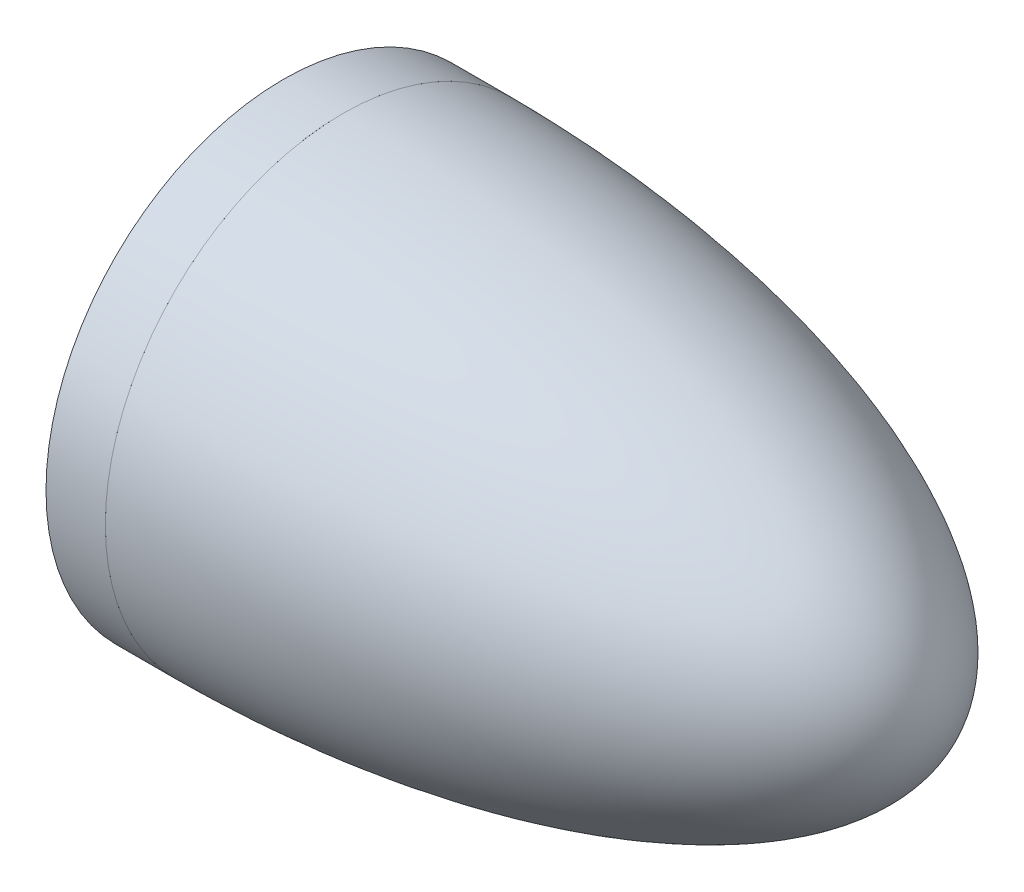
from build123d import *

# Parameters (mm, degrees)
SKETCH6_R           = 20
BOSS_EXTRUDE6_DEPTH = 5
SKETCH7_W           = 2.51
SKETCH7_H           = 2.51
CUT_EXTRUDE2_DEPTH  = 4


with BuildPart() as part:
    # Sketch5 → Revolve1 (revolve)
    with BuildSketch(Plane.XY, mode=Mode.PRIVATE) as revolve1_sk:
        with BuildLine():
            Line((-0.328961319, 20), (0, 0))
            Line((0, 0), (49.671038681, 0))
            add(Edge.make_bspline(
                [(-0.328961319, 20), (-0.105238787, 20), (0.346683768, 19.998738518), (1.17344146, 19.993061836), (2.07946465, 19.97791728), (3.088023411, 19.955183498), (4.039946825, 19.924840097), (5.023208706, 19.886859758), (5.988955504, 19.841208052), (7.206007116, 19.774502332), (8.660085037, 19.678931594), (10.358210996, 19.544546485), (12.294101895, 19.358997269), (14.227685252, 19.140764557), (16.156551584, 18.888978238), (18.080976902, 18.602600939), (19.999508375, 18.280402065), (21.911557404, 17.920937974), (23.815801584, 17.522506625), (26.184896379, 16.973278777), (28.536388947, 16.351883769), (30.865797773, 15.651486078), (33.626471787, 14.704732977), (36.158486008, 13.715434332), (38.632307398, 12.58508043), (41.01950592, 11.282461155), (42.901793813, 10.082177334), (44.375669895, 8.994767711), (45.639838989, 7.904036264), (46.6882672, 6.838589372), (47.489746286, 5.877342008), (48.134030074, 4.956724542), (48.638593095, 4.08034154), (49.033772714, 3.23104563), (49.343490389, 2.35581971), (49.563253783, 1.448045849), (49.651047512, 0.731297667), (49.67103155, 0.248502323), (49.671038681, 0)],
                knots=[0.079977795, 0.079977795, 0.079977795, 0.079977795, 0.079977795, 0.095532234, 0.111086674, 0.126641113, 0.142195553, 0.157749993, 0.173304433, 0.188858873, 0.204413313, 0.235522191, 0.266631069, 0.297739947, 0.328848826, 0.359957705, 0.391066585, 0.422175461, 0.453284338, 0.484393222, 0.515502106, 0.577719847, 0.608828732, 0.639937617, 0.702155324, 0.751534088, 0.78264288, 0.813751735, 0.844860411, 0.868585912, 0.889324944, 0.909266927, 0.924820517, 0.940371705, 0.953929868, 0.969106253, 0.984110411, 1, 1, 1, 1, 1], degree=4))
        make_face()
    revolve(revolve1_sk.sketch.rotate(Axis((0, 0, 0), (1, 0, 0)), 180), axis=Axis((0, 0, 0), (1, 0, 0)))

    # Sketch6 → Boss-Extrude6 (add)
    with BuildSketch(Plane(origin=(0, 0, 0), x_dir=(0, 0, -1), z_dir=(1, 0, 0))):
        Circle(SKETCH6_R)
    extrude(amount=-BOSS_EXTRUDE6_DEPTH)

    # Sketch7 → Cut-Extrude2 (cut)
    with BuildSketch(Plane.ZY.offset(5)):
        with Locations((-0.088426048, 16.198942945)):
            Rectangle(SKETCH7_W, SKETCH7_H)
    extrude(amount=-CUT_EXTRUDE2_DEPTH, mode=Mode.SUBTRACT)


solid = part.part
